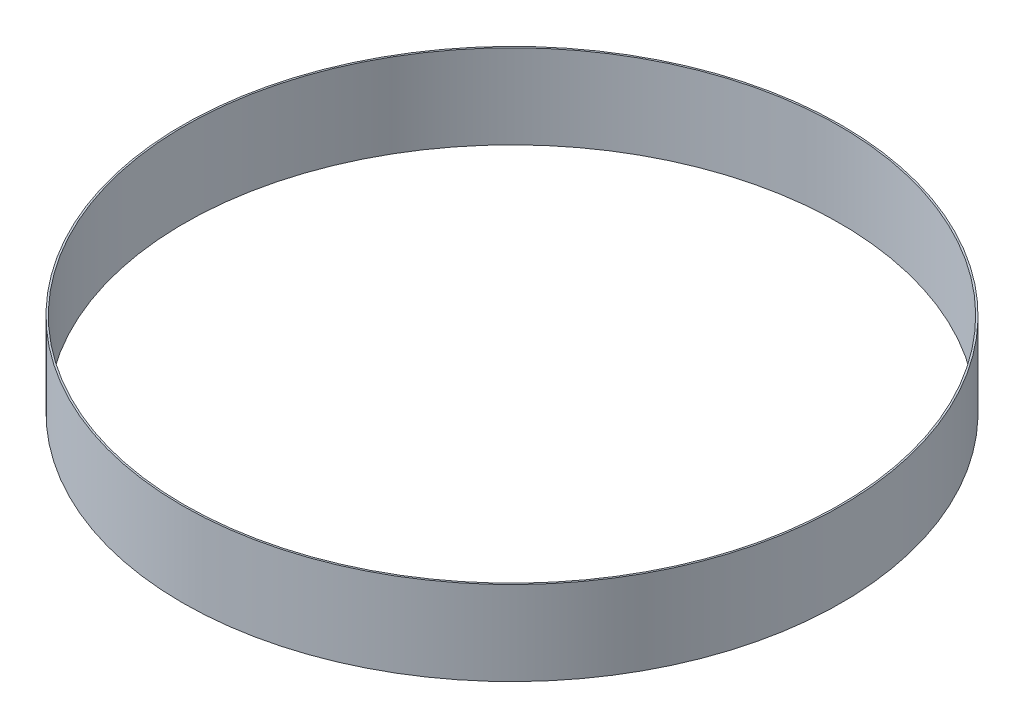
from build123d import *

# Parameters (mm, degrees)
SKETCH1_R           = 19.6
SKETCH1_R_2         = 19.5
BOSS_EXTRUDE1_DEPTH = 5


with BuildPart() as part:
    # Sketch1 → Boss-Extrude1 (new body)
    with BuildSketch(Plane(origin=(0, 0, 0), x_dir=(1, 0, 0), z_dir=(0, 1, 0))):
        with Locations(Location((0, 0, 0), (0, 0, 270))):
            Circle(SKETCH1_R)
        with Locations(Location((0, 0, 0), (0, 0, 270))):
            Circle(SKETCH1_R_2, mode=Mode.SUBTRACT)
    extrude(amount=BOSS_EXTRUDE1_DEPTH)


solid = part.part
